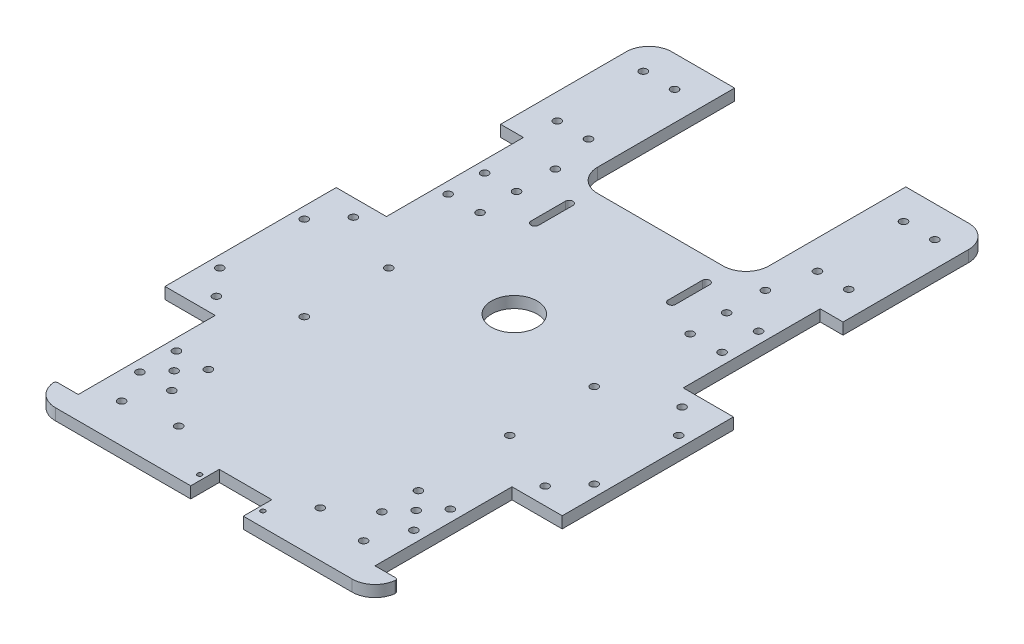
from build123d import *

# Parameters (mm, degrees)
SKETCH_1_R          = 1
SKETCH_1_R_2        = 1.65
SKETCH_1_R_3        = 10
EXTRUDE_2_DEPTH     = 5
CUT_EXTRUDE_1_DEPTH = 5
SKETCH_4_R          = 1.65
CUT_EXTRUDE_3_DEPTH = 5
SKETCH_5_R          = 1.65
CUT_EXTRUDE_4_DEPTH = 5


with BuildPart() as part:
    # 草图1 → 凸台-拉伸2 (new body)
    with BuildSketch(Plane(origin=(0, 0, 0), x_dir=(1, 0, 0), z_dir=(0, 1, 0))):
        with BuildLine():
            Line((-43.8590831, 198.080740626), (-16.3590831, 198.080740626))
            Line((-16.3590831, 198.080740626), (-16.3590831, 138.080740626))
            ThreePointArc((-16.3590831, 138.080740626), (-13.430150911, 131.009672814), (-6.3590831, 128.080740626))
            Line((-6.3590831, 128.080740626), (48.6409169, 128.080740626))
            ThreePointArc((48.6409169, 128.080740626), (55.711984712, 131.009672814), (58.6409169, 138.080740626))
            Line((58.6409169, 138.080740626), (58.6409169, 198.080740626))
            Line((58.6409169, 198.080740626), (86.1409169, 198.080740626))
            ThreePointArc((86.1409169, 198.080740626), (93.211984712, 195.151808438), (96.1409169, 188.080740626))
            Line((96.1409169, 188.080740626), (96.1409169, 133.080740626))
            Line((96.1409169, 133.080740626), (86.1409169, 133.080740626))
            Line((86.1409169, 133.080740626), (86.1409169, 73.080740626))
            Line((86.1409169, 73.080740626), (108.1409169, 73.080740626))
            Line((108.1409169, 73.080740626), (108.1409169, -1.919259374))
            Line((108.1409169, -1.919259374), (86.1409169, -1.919259374))
            Line((86.1409169, -1.919259374), (86.1409169, -61.919259374))
            Line((86.1409169, -61.919259374), (95.08518881, -61.919259374))
            ThreePointArc((95.08518881, -61.919259374), (95.830544803, -62.252592707), (96.0789968, -63.030370485))
            ThreePointArc((96.0789968, -63.030370485), (92.807583567, -69.372819299), (86.1409169, -71.919259374))
            Line((86.1409169, -71.919259374), (38.4459169, -71.919259374))
            Line((38.4459169, -71.919259374), (38.4459169, -59.419259374))
            Line((38.4459169, -59.419259374), (15.4159169, -59.419259374))
            Line((15.4159169, -59.419259374), (15.4159169, -71.919259374))
            Line((15.4159169, -71.919259374), (-43.8590831, -71.919259374))
            ThreePointArc((-43.8590831, -71.919259374), (-50.525749766, -69.372819299), (-53.797163, -63.030370485))
            ThreePointArc((-53.797163, -63.030370485), (-53.548711002, -62.252592707), (-52.80335501, -61.919259374))
            Line((-52.80335501, -61.919259374), (-43.8590831, -61.919259374))
            Line((-43.8590831, -61.919259374), (-43.8590831, -1.919259374))
            Line((-43.8590831, -1.919259374), (-65.8590831, -1.919259374))
            Line((-65.8590831, -1.919259374), (-65.8590831, 73.080740626))
            Line((-65.8590831, 73.080740626), (-43.8590831, 73.080740626))
            Line((-43.8590831, 73.080740626), (-43.8590831, 133.080740626))
            Line((-43.8590831, 133.080740626), (-53.8590831, 133.080740626))
            Line((-53.8590831, 133.080740626), (-53.8590831, 188.080740626))
            ThreePointArc((-53.8590831, 188.080740626), (-50.930150911, 195.151808438), (-43.8590831, 198.080740626))
        make_face()
        with Locations(Location((13.0959169, -65.669259374, 0), (0, 0, 270))):
            Circle(SKETCH_1_R, mode=Mode.SUBTRACT)
        with Locations(Location((40.7659169, -65.669259374, 0), (0, 0, 270))):
            Circle(SKETCH_1_R, mode=Mode.SUBTRACT)
        with Locations(Location((66.1409169, 17.080740626, 0), (0, 0, 90))):
            Circle(SKETCH_1_R_2, mode=Mode.SUBTRACT)
        with Locations(Location((-60.8590831, 54.080740626, 0), (0, 0, 270))):
            Circle(SKETCH_1_R_2, mode=Mode.SUBTRACT)
        with Locations(Location((-23.8590831, 54.080740626, 0), (0, 0, 270))):
            Circle(SKETCH_1_R_2, mode=Mode.SUBTRACT)
        with Locations(Location((-23.8590831, 17.080740626, 0), (0, 0, 270))):
            Circle(SKETCH_1_R_2, mode=Mode.SUBTRACT)
        with Locations(Location((-60.8590831, 17.080740626, 0), (0, 0, 270))):
            Circle(SKETCH_1_R_2, mode=Mode.SUBTRACT)
        with Locations(Location((103.1409169, 17.080740626, 0), (0, 0, 90))):
            Circle(SKETCH_1_R_2, mode=Mode.SUBTRACT)
        with Locations(Location((103.1409169, 54.080740626, 0), (0, 0, 90))):
            Circle(SKETCH_1_R_2, mode=Mode.SUBTRACT)
        with Locations(Location((66.1409169, 54.080740626, 0), (0, 0, 90))):
            Circle(SKETCH_1_R_2, mode=Mode.SUBTRACT)
        with Locations(Location((-38.8590831, 111.080740626, 0), (0, 0, 270))):
            Circle(SKETCH_1_R_2, mode=Mode.SUBTRACT)
        with Locations(Location((-24.8590831, 111.080740626, 0), (0, 0, 270))):
            Circle(SKETCH_1_R_2, mode=Mode.SUBTRACT)
        with Locations(Location((-24.8590831, 95.080740626, 0), (0, 0, 270))):
            Circle(SKETCH_1_R_2, mode=Mode.SUBTRACT)
        with Locations(Location((-38.8590831, 95.080740626, 0), (0, 0, 270))):
            Circle(SKETCH_1_R_2, mode=Mode.SUBTRACT)
        with Locations(Location((-38.8590831, -23.919259374, 0), (0, 0, 270))):
            Circle(SKETCH_1_R_2, mode=Mode.SUBTRACT)
        with Locations(Location((-24.8590831, -23.919259374, 0), (0, 0, 270))):
            Circle(SKETCH_1_R_2, mode=Mode.SUBTRACT)
        with Locations(Location((-38.8590831, -39.919259374, 0), (0, 0, 270))):
            Circle(SKETCH_1_R_2, mode=Mode.SUBTRACT)
        with Locations(Location((-24.8590831, -39.919259374, 0), (0, 0, 270))):
            Circle(SKETCH_1_R_2, mode=Mode.SUBTRACT)
        with Locations(Location((-29.0090831, 184.430740626, 0), (0, 0, 270))):
            Circle(SKETCH_1_R_2, mode=Mode.SUBTRACT)
        with Locations(Location((-42.7090831, 184.430740626, 0), (0, 0, 270))):
            Circle(SKETCH_1_R_2, mode=Mode.SUBTRACT)
        with Locations(Location((-42.7090831, 146.730740626, 0), (0, 0, 270))):
            Circle(SKETCH_1_R_2, mode=Mode.SUBTRACT)
        with Locations(Location((-29.0090831, 146.730740626, 0), (0, 0, 270))):
            Circle(SKETCH_1_R_2, mode=Mode.SUBTRACT)
        with Locations(Location((-24.8590831, 128.080740626, 0), (0, 0, 270))):
            Circle(SKETCH_1_R_2, mode=Mode.SUBTRACT)
        with Locations(Location((-9.8590831, -51.919259374, 0), (0, 0, 270))):
            Circle(SKETCH_1_R_2, mode=Mode.SUBTRACT)
        with Locations(Location((52.1409169, -51.919259374, 0), (0, 0, 90))):
            Circle(SKETCH_1_R_2, mode=Mode.SUBTRACT)
        with Locations(Location((67.1409169, -39.919259374, 0), (0, 0, 90))):
            Circle(SKETCH_1_R_2, mode=Mode.SUBTRACT)
        with Locations(Location((81.1409169, -39.919259374, 0), (0, 0, 90))):
            Circle(SKETCH_1_R_2, mode=Mode.SUBTRACT)
        with Locations(Location((67.1409169, -23.919259374, 0), (0, 0, 90))):
            Circle(SKETCH_1_R_2, mode=Mode.SUBTRACT)
        with Locations(Location((81.1409169, -23.919259374, 0), (0, 0, 90))):
            Circle(SKETCH_1_R_2, mode=Mode.SUBTRACT)
        with Locations(Location((81.1409169, 95.080740626, 0), (0, 0, 90))):
            Circle(SKETCH_1_R_2, mode=Mode.SUBTRACT)
        with Locations(Location((67.1409169, 95.080740626, 0), (0, 0, 90))):
            Circle(SKETCH_1_R_2, mode=Mode.SUBTRACT)
        with Locations(Location((67.1409169, 111.080740626, 0), (0, 0, 90))):
            Circle(SKETCH_1_R_2, mode=Mode.SUBTRACT)
        with Locations(Location((81.1409169, 111.080740626, 0), (0, 0, 90))):
            Circle(SKETCH_1_R_2, mode=Mode.SUBTRACT)
        with Locations(Location((67.1409169, 128.080740626, 0), (0, 0, 90))):
            Circle(SKETCH_1_R_2, mode=Mode.SUBTRACT)
        with Locations(Location((71.2909169, 146.730740626, 0), (0, 0, 90))):
            Circle(SKETCH_1_R_2, mode=Mode.SUBTRACT)
        with Locations(Location((84.9909169, 146.730740626, 0), (0, 0, 90))):
            Circle(SKETCH_1_R_2, mode=Mode.SUBTRACT)
        with Locations(Location((84.9909169, 184.430740626, 0), (0, 0, 90))):
            Circle(SKETCH_1_R_2, mode=Mode.SUBTRACT)
        with Locations(Location((71.2909169, 184.430740626, 0), (0, 0, 90))):
            Circle(SKETCH_1_R_2, mode=Mode.SUBTRACT)
        with Locations(Location((21.1409169, 64.080740626, 0), (0, 0, 270))):
            Circle(SKETCH_1_R_3, mode=Mode.SUBTRACT)
    extrude(amount=EXTRUDE_2_DEPTH)

    # 草图2 → 切除-拉伸1 (cut)
    with BuildSketch(Plane(origin=(0, 5, 0), x_dir=(1, 0, 0), z_dir=(0, 1, 0))):
        with BuildLine():
            Line((52.7909169, 118.080740626), (52.7909169, 103.080740626))
            ThreePointArc((52.7909169, 103.080740626), (51.1409169, 101.430740626), (49.4909169, 103.080740626))
            Line((49.4909169, 103.080740626), (49.4909169, 118.080740626))
            ThreePointArc((49.4909169, 118.080740626), (51.1409169, 119.730740626), (52.7909169, 118.080740626))
        make_face()
        with BuildLine():
            Line((-7.2090831, 118.080740626), (-7.2090831, 103.080740626))
            ThreePointArc((-7.2090831, 103.080740626), (-8.8590831, 101.430740626), (-10.5090831, 103.080740626))
            Line((-10.5090831, 103.080740626), (-10.5090831, 118.080740626))
            ThreePointArc((-10.5090831, 118.080740626), (-8.8590831, 119.730740626), (-7.2090831, 118.080740626))
        make_face()
    extrude(amount=-CUT_EXTRUDE_1_DEPTH, mode=Mode.SUBTRACT)

    # 草图4 → 切除-拉伸3 (cut)
    with BuildSketch(Plane.XZ):
        with Locations(Location((-31.8590831, 31.919259374, 0), (0, 0, 270))):
            Circle(SKETCH_4_R)
        with Locations(Location((-31.8590831, 54.919259374, 0), (0, 0, 270))):
            Circle(SKETCH_4_R)
        with Locations(Location((74.1409169, 31.919259374, 0), (0, 0, 270))):
            Circle(SKETCH_4_R)
        with Locations(Location((74.1409169, 54.919259374, 0), (0, 0, 270))):
            Circle(SKETCH_4_R)
    extrude(amount=-CUT_EXTRUDE_3_DEPTH, mode=Mode.SUBTRACT)

    # 草图5 → 切除-拉伸4 (cut)
    with BuildSketch(Plane.XZ):
        with Locations(Location((93.1409169, -65.580740626, 0), (0, 0, 270))):
            Circle(SKETCH_5_R)
        with Locations(Location((93.1409169, -5.580740626, 0), (0, 0, 270))):
            Circle(SKETCH_5_R)
        with Locations(Location((-50.8590831, -5.580740626, 0), (0, 0, 90))):
            Circle(SKETCH_5_R)
        with Locations(Location((-50.8590831, -65.580740626, 0), (0, 0, 90))):
            Circle(SKETCH_5_R)
    extrude(amount=-CUT_EXTRUDE_4_DEPTH, mode=Mode.SUBTRACT)


solid = part.part
